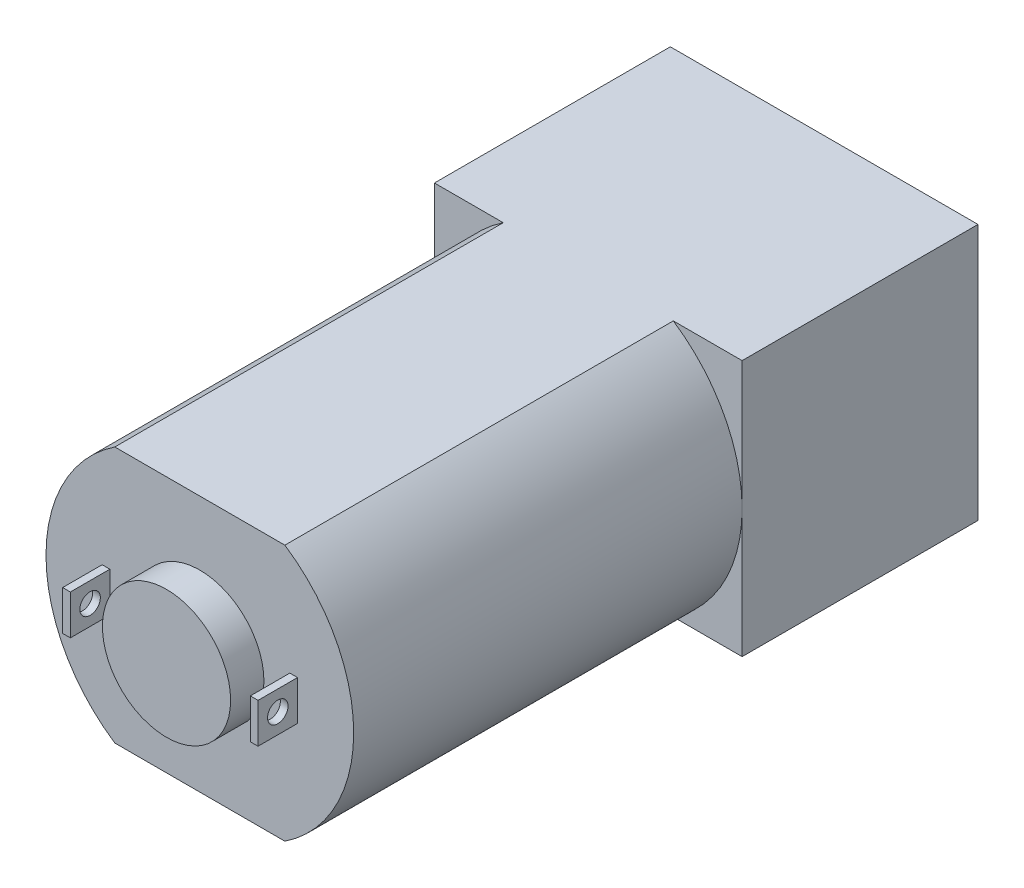
from build123d import *

# Parameters (mm, degrees)
BOSS_EXTRUDE1_DEPTH   = 15.15
SKETCH3_W             = 12
SKETCH3_H             = 10
BOSS_EXTRUDE2_DEPTH   = 9.2
SKETCH4_R             = 2.5
BOSS_EXTRUDE3_DEPTH   = 1.3
SKETCH5_W             = 0.3
SKETCH5_H             = 1.55
BOSS_EXTRUDE4_DEPTH   = 1.54
BOSS_EXTRUDE4_2_DEPTH = 1.54
SKETCH6_R             = 0.4
CUT_EXTRUDE1_DEPTH    = 0.3
SKETCH7_R             = 0.4
CUT_EXTRUDE2_DEPTH    = 0.3
SKETCH8_R             = 2
BOSS_EXTRUDE5_DEPTH   = 0.7


with BuildPart() as part:
    # Sketch1 → Boss-Extrude1 (new body)
    with BuildSketch(Plane.XY):
        with BuildLine():
            Line((3.31662479, 5), (-3.31662479, 5))
            ThreePointArc((-3.31662479, 5), (-6, 0), (-3.31662479, -5))
            Line((-3.31662479, -5), (3.31662479, -5))
            ThreePointArc((3.31662479, -5), (6, 0), (3.31662479, 5))
        make_face()
    extrude(amount=BOSS_EXTRUDE1_DEPTH)

    # Sketch3 → Boss-Extrude2 (add)
    with BuildSketch(Plane(origin=(0, 0, 0), x_dir=(-1, 0, 0), z_dir=(0, 0, -1))):
        Rectangle(SKETCH3_W, SKETCH3_H)
    extrude(amount=BOSS_EXTRUDE2_DEPTH)

    # Sketch4 → Boss-Extrude3 (add)
    with BuildSketch(Plane.XY.offset(15.15)):
        Circle(SKETCH4_R)
    extrude(amount=BOSS_EXTRUDE3_DEPTH)

    # Sketch8 → Boss-Extrude5 (add)
    with BuildSketch(Plane(origin=(0, 0, -9.2), x_dir=(-1, 0, 0), z_dir=(0, 0, -1))):
        Circle(SKETCH8_R)
    extrude(amount=BOSS_EXTRUDE5_DEPTH)


with BuildPart() as body_2:
    # Sketch5 → Boss-Extrude4 (new body)
    with BuildSketch(Plane.XY.offset(15.15)):
        with Locations((-3.66, 0)):
            Rectangle(SKETCH5_W, SKETCH5_H)
    extrude(amount=BOSS_EXTRUDE4_DEPTH)

    # Sketch6 → Cut-Extrude1 (cut)
    with BuildSketch(Plane.ZY.offset(3.81)):
        with Locations(Location((15.92, 0, 0), (0, 0, 270))):
            Circle(SKETCH6_R)
    extrude(amount=-CUT_EXTRUDE1_DEPTH, mode=Mode.SUBTRACT)


with BuildPart() as body_3:
    # Sketch5 → Boss-Extrude4 2 (new body)
    with BuildSketch(Plane.XY.offset(15.15)):
        with Locations((3.66, 0)):
            Rectangle(SKETCH5_W, SKETCH5_H)
    extrude(amount=BOSS_EXTRUDE4_2_DEPTH)

    # Sketch7 → Cut-Extrude2 (cut)
    with BuildSketch(Plane.ZY.offset(-3.51)):
        with Locations(Location((15.92, 0, 0), (0, 0, 270))):
            Circle(SKETCH7_R)
    extrude(amount=-CUT_EXTRUDE2_DEPTH, mode=Mode.SUBTRACT)


solid = Compound([part.part, body_2.part, body_3.part])
